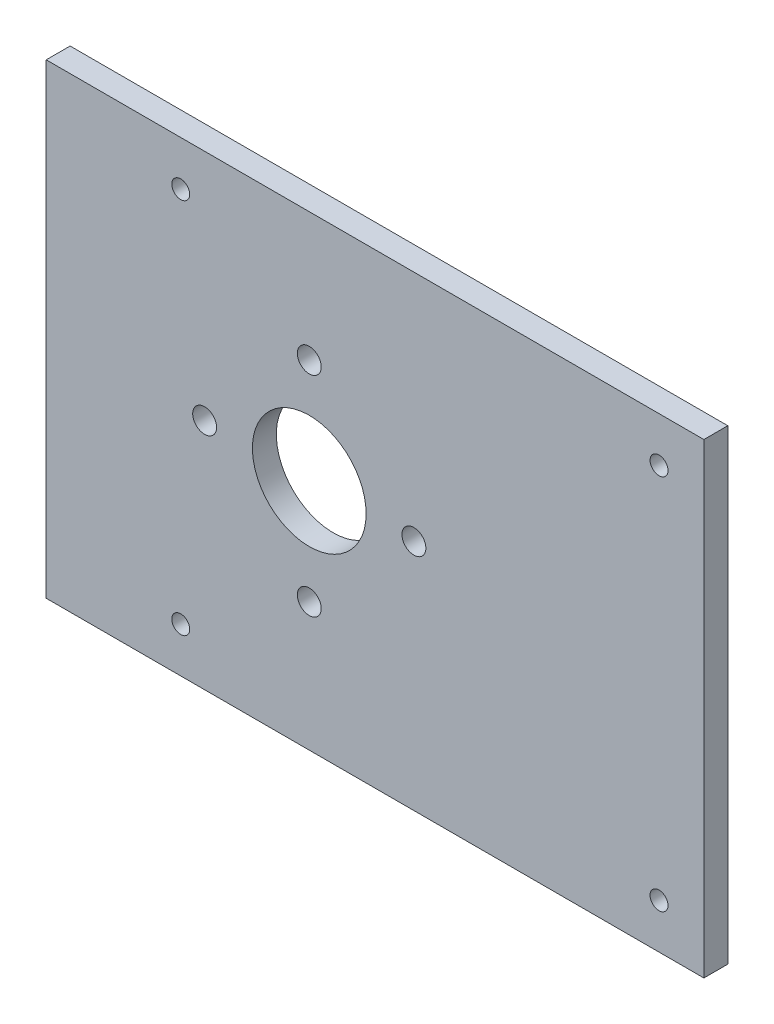
from build123d import *

# Parameters (mm, degrees)
SKETCH_1_W          = 110
SKETCH_1_H          = 78
SKETCH_1_R          = 1.5
EXTRUDE_1_DEPTH     = 4
SKETCH_4_R          = 2
SKETCH_4_R_2        = 9.51
CUT_EXTRUDE_1_DEPTH = 68.542579163


with BuildPart() as part:
    # 草图1 → 凸台-拉伸1 (new body)
    with BuildSketch(Plane.XY):
        Rectangle(SKETCH_1_W, SKETCH_1_H)
        with Locations((-32.5, 31.5)):
            Circle(SKETCH_1_R, mode=Mode.SUBTRACT)
        with Locations((47.5, 31.5)):
            Circle(SKETCH_1_R, mode=Mode.SUBTRACT)
        with Locations((47.5, -31.5)):
            Circle(SKETCH_1_R, mode=Mode.SUBTRACT)
        with Locations((-32.5, -31.5)):
            Circle(SKETCH_1_R, mode=Mode.SUBTRACT)
    extrude(amount=EXTRUDE_1_DEPTH)

    # 草图4 → 切除-拉伸1 (cut, through all)
    with BuildSketch(Plane.XY.offset(4)):
        with Locations((-11, 17.5)):
            Circle(SKETCH_4_R)
        with Locations((-28.5, 0)):
            Circle(SKETCH_4_R)
        with Locations((-11, -17.5)):
            Circle(SKETCH_4_R)
        with Locations((6.5, 0)):
            Circle(SKETCH_4_R)
        with Locations((-11, 0)):
            Circle(SKETCH_4_R_2)
    extrude(amount=-CUT_EXTRUDE_1_DEPTH, mode=Mode.SUBTRACT)


solid = part.part
